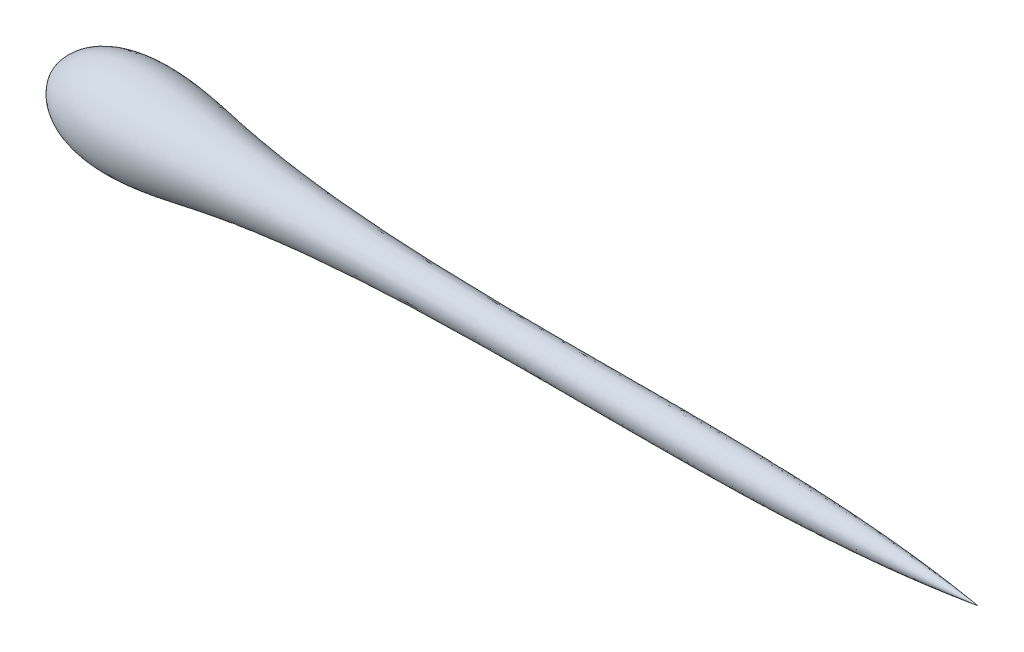
from build123d import *


with BuildPart() as part:
    # 草图1 → 旋转1 (revolve)
    with BuildSketch(Plane.XY):
        with BuildLine():
            Line((0, 0), (1000, 0))
            add(Edge.make_bspline(
                [(0, 0), (13.04893632, 40.964875521), (87.334832765, 54.264476089), (203.114596793, 30.809677557), (338.15688901, 19.411844986), (515.962890225, 16.521412853), (735.371820765, 18.631157633), (903.034041004, 12.949998009), (1000, 0)],
                knots=[0, 0, 0, 0, 0.112571757, 0.188390375, 0.354932677, 0.506691733, 0.712749163, 1, 1, 1, 1], degree=3))
        make_face()
    revolve(axis=Axis((0, 0, 0), (1, 0, 0)))


solid = part.part
